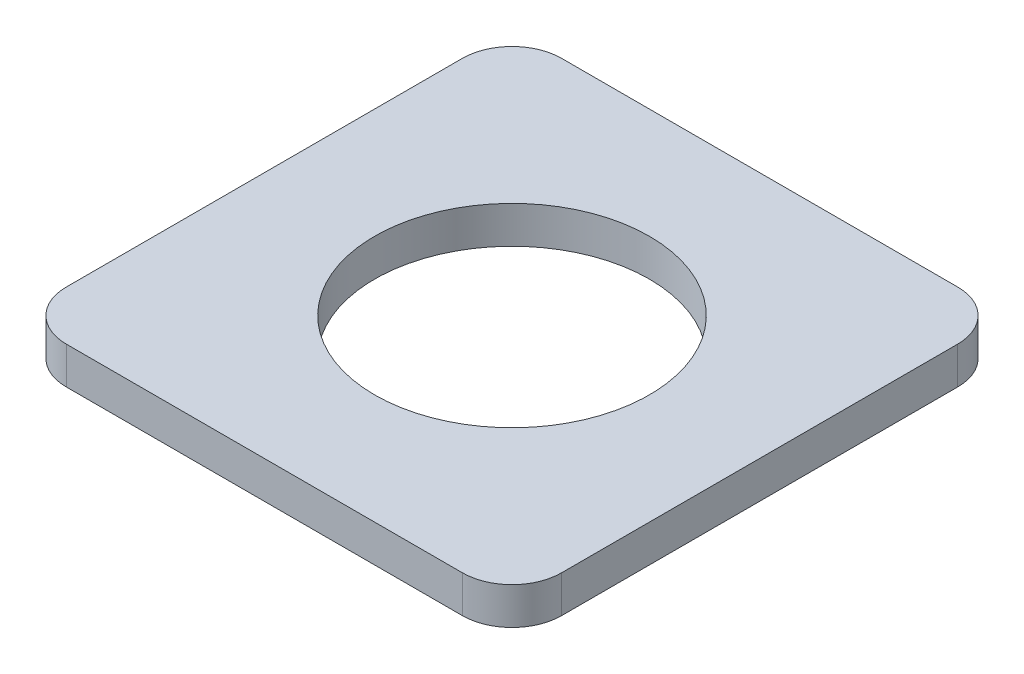
from build123d import *

# Parameters (mm, degrees)
SKETCH_1_R      = 11.1
EXTRUDE_1_DEPTH = 3


with BuildPart() as part:
    # 草图1 → 凸台-拉伸1 (new body)
    with BuildSketch(Plane(origin=(0, 0, 0), x_dir=(1, 0, 0), z_dir=(0, 1, 0))):
        with BuildLine():
            Line((-16, -20), (16, -20))
            ThreePointArc((16, -20), (18.828427125, -18.828427125), (20, -16))
            Line((20, -16), (20, 16))
            ThreePointArc((20, 16), (18.828427125, 18.828427125), (16, 20))
            Line((16, 20), (-16, 20))
            ThreePointArc((-16, 20), (-18.828427125, 18.828427125), (-20, 16))
            Line((-20, 16), (-20, -16))
            ThreePointArc((-20, -16), (-18.828427125, -18.828427125), (-16, -20))
        make_face()
        with Locations(Location((0, 0, 0), (0, 0, 270))):
            Circle(SKETCH_1_R, mode=Mode.SUBTRACT)
    extrude(amount=EXTRUDE_1_DEPTH)


solid = part.part
